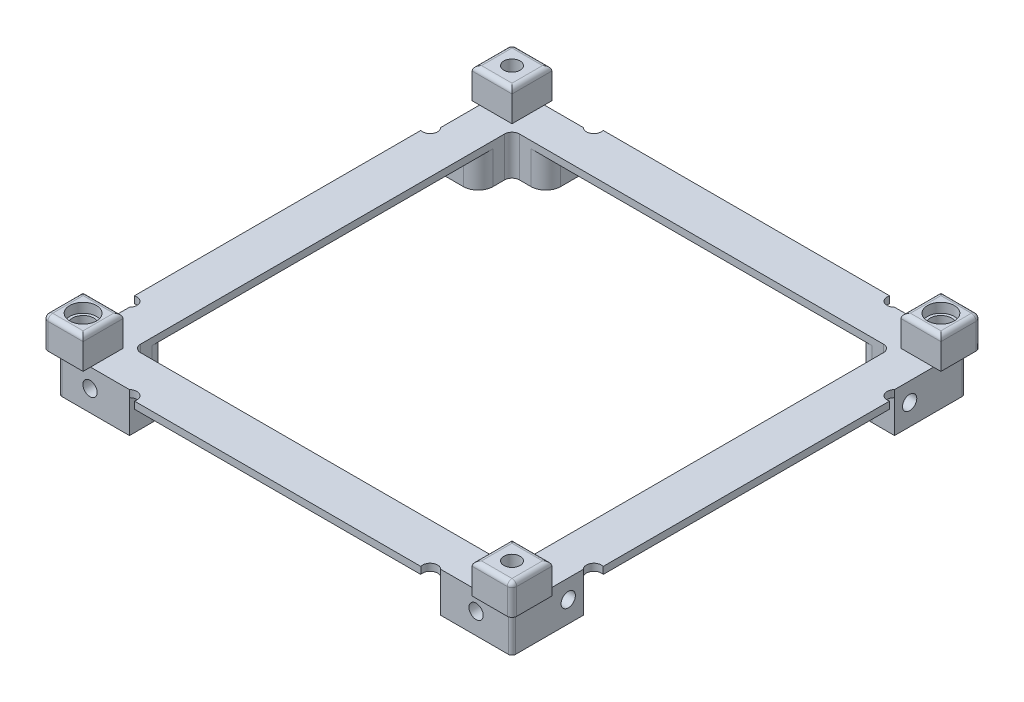
from build123d import *

# Parameters (mm, degrees)
SKETCH1_W                         = 100
SKETCH1_H                         = 100
BOSS_EXTRUDE1_DEPTH               = 8.5
CUT_EXTRUDE1_DEPTH                = 142.676568281
SKETCH3_W                         = 8.5
SKETCH3_H                         = 8.5
BOSS_EXTRUDE2_DEPTH               = 6.5
TAP_DRILL_FOR_4_HELICOIL5_D       = 3.048
TAP_DRILL_FOR_4_HELICOIL5_DEPTH   = 5.69
TAP_DRILL_FOR_4_HELICOIL5_TIP     = 0.915711583
TAP_DRILL_FOR_4_HELICOIL5_4_D     = 3.048
TAP_DRILL_FOR_4_HELICOIL5_4_DEPTH = 5.69
TAP_DRILL_FOR_4_HELICOIL5_4_TIP   = 0.915711583
CUT_EXTRUDE2_DEPTH                = 7
CUT_EXTRUDE3_DEPTH                = 142.647449677
FILLET1_R                         = 1
FILLET2_R                         = 3.175
FILLET3_R                         = 0.79
TAP_DRILL_FOR_4_HELICOIL5_5_D     = 3.048
TAP_DRILL_FOR_4_HELICOIL5_5_DEPTH = 5.69
TAP_DRILL_FOR_4_HELICOIL5_5_TIP   = 0.915711583
TAP_DRILL_FOR_8_32_TAP1_D         = 3.4544
TAP_DRILL_FOR_8_32_TAP1_DEPTH     = 11.0998
TAP_DRILL_FOR_8_32_TAP1_TIP       = 1.037806461
SKETCH27_R                        = 2.8575
CUT_EXTRUDE4_DEPTH                = 2.032
SKETCH28_R                        = 2.286
CUT_EXTRUDE5_DEPTH                = 4.318
F_4_CLEARANCE_HOLE1_D             = 3.4544


with BuildPart() as part:
    # Sketch1 → Boss-Extrude1 (new body)
    with BuildSketch(Plane(origin=(0, 0, 0), x_dir=(1, 0, 0), z_dir=(0, 1, 0))):
        with Locations((50, 50)):
            Rectangle(SKETCH1_W, SKETCH1_H)
    extrude(amount=BOSS_EXTRUDE1_DEPTH)

    # Sketch2 → Cut-Extrude1 (cut, through all)
    with BuildSketch(Plane(origin=(0, 8.5, 0), x_dir=(1, 0, 0), z_dir=(0, 1, 0))):
        with BuildLine():
            Line((19.05, 100), (0, 100))
            Line((0, 100), (0, 83.590412453))
            Line((0, 83.590412453), (0, 80.95))
            Line((0, 80.95), (0, 80.554651577))
            ThreePointArc((0, 80.554651577), (1.825498063, 81.254538032), (1.5875, 83.19506403))
            Line((1.5875, 83.19506403), (1.5875, 98.4125))
            Line((1.5875, 98.4125), (16.80493597, 98.4125))
            ThreePointArc((16.80493597, 98.4125), (18.745461968, 98.174501937), (19.445348423, 100))
            Line((19.445348423, 100), (19.05, 100))
        make_face()
        with BuildLine():
            Line((80.95, 100), (80.554651577, 100))
            ThreePointArc((80.554651577, 100), (81.254538032, 98.174501937), (83.19506403, 98.4125))
            Line((83.19506403, 98.4125), (98.4125, 98.4125))
            Line((98.4125, 98.4125), (98.4125, 83.19506403))
            ThreePointArc((98.4125, 83.19506403), (98.174501937, 81.254538032), (100, 80.554651577))
            Line((100, 80.554651577), (100, 80.95))
            Line((100, 80.95), (100, 83.590412453))
            Line((100, 83.590412453), (100, 100))
            Line((100, 100), (80.95, 100))
        make_face()
        with BuildLine():
            Line((1.5875, 1.5875), (16.80493597, 1.5875))
            ThreePointArc((16.80493597, 1.5875), (18.745461968, 1.825498063), (19.445348423, 0))
            Line((19.445348423, 0), (19.05, 0))
            Line((19.05, 0), (0, 0))
            Line((0, 0), (0, 19.05))
            Line((0, 19.05), (0, 19.445348423))
            ThreePointArc((0, 19.445348423), (1.825498063, 18.745461968), (1.5875, 16.80493597))
            Line((1.5875, 16.80493597), (1.5875, 1.5875))
        make_face()
        with BuildLine():
            Line((98.4125, 1.5875), (83.19506403, 1.5875))
            ThreePointArc((83.19506403, 1.5875), (81.254538032, 1.825498063), (80.554651577, 0))
            Line((80.554651577, 0), (80.95, 0))
            Line((80.95, 0), (100, 0))
            Line((100, 0), (100, 19.05))
            Line((100, 19.05), (100, 19.445348423))
            ThreePointArc((100, 19.445348423), (98.174501937, 18.745461968), (98.4125, 16.80493597))
            Line((98.4125, 16.80493597), (98.4125, 1.5875))
        make_face()
    extrude(amount=-CUT_EXTRUDE1_DEPTH, mode=Mode.SUBTRACT)

    # Sketch3 → Boss-Extrude2 (add)
    with BuildSketch(Plane(origin=(0, 8.5, 0), x_dir=(1, 0, 0), z_dir=(0, 1, 0))):
        with Locations((4.25, 4.25)):
            Rectangle(SKETCH3_W, SKETCH3_H)
        with Locations((95.75, 4.25)):
            Rectangle(SKETCH3_W, SKETCH3_H)
        with Locations((95.75, 95.75)):
            Rectangle(SKETCH3_W, SKETCH3_H)
        with Locations((4.25, 95.75)):
            Rectangle(SKETCH3_W, SKETCH3_H)
    extrude(amount=BOSS_EXTRUDE2_DEPTH)

    # Tap Drill for _4 Helicoil5
    with Locations(Plane(origin=(0, 0, 0), x_dir=(-1, 0, 0), z_dir=(0, -1, 0))):
        with Locations((-87.465, 7.1375), (-90.005, 92.8625), (-13.805, 7.1375), (-9.995, 92.8625)):
            Hole(TAP_DRILL_FOR_4_HELICOIL5_D / 2, depth=TAP_DRILL_FOR_4_HELICOIL5_DEPTH)
            with Locations((0, 0, -(TAP_DRILL_FOR_4_HELICOIL5_DEPTH + TAP_DRILL_FOR_4_HELICOIL5_TIP / 2))):  # 118° drill point
                Cone(0, TAP_DRILL_FOR_4_HELICOIL5_D / 2, TAP_DRILL_FOR_4_HELICOIL5_TIP, mode=Mode.SUBTRACT)

    # Sketch18 → Tap Drill for _4 Helicoil5 2 (revolve, cut)
    with BuildSketch(Plane(origin=(1.5875, 4.5, -86.4125), x_dir=(0, 0, 1), z_dir=(0, 1, 0))):
        Polygon((0, 0), (0, 6.605711583), (1.524, 5.69), (1.524, 0), align=None)
    tap_drill_for_4_helicoil5_2 = revolve(axis=Axis((-4.7625, 4.5, -86.4125), (1, 0, 0)), mode=Mode.SUBTRACT)

    # Mirror1: Tap Drill for _4 Helicoil5 2 across plane
    add(tap_drill_for_4_helicoil5_2.mirror(Plane(origin=(0, 0, -50), x_dir=(1, 0, 0), z_dir=(0, 0, -1))), mode=Mode.SUBTRACT)

    # Mirror2: Tap Drill for _4 Helicoil5 2 across plane
    add(tap_drill_for_4_helicoil5_2.mirror(Plane.ZY.offset(-50)), mode=Mode.SUBTRACT)

    # Mirror2 copy 1 sketch → Mirror2 copy 1 (revolve, cut)
    with BuildSketch(Plane(origin=(98.4125, 4.5, -13.5875), x_dir=(0, 0, -1), z_dir=(0, 1, 0))):
        Polygon((0, 0), (0, 6.605711583), (1.524, 5.69), (1.524, 0), align=None)
    revolve(axis=Axis((104.7625, 4.5, -13.5875), (-1, 0, 0)), mode=Mode.SUBTRACT)

    # Sketch21 → Tap Drill for _4 Helicoil5 3 (revolve, cut)
    with BuildSketch(Plane(origin=(13.5875, 4.5, -98.4125), x_dir=(0, 1, 0), z_dir=(1, 0, 0))):
        Polygon((0, 0), (0, 6.605711583), (1.524, 5.69), (1.524, 0), align=None)
    tap_drill_for_4_helicoil5_3 = revolve(axis=Axis((13.5875, 4.5, -104.7625), (0, 0, 1)), mode=Mode.SUBTRACT)

    # Mirror3: Tap Drill for _4 Helicoil5 3 across plane
    add(tap_drill_for_4_helicoil5_3.mirror(Plane.ZY.offset(-50)), mode=Mode.SUBTRACT)

    # Tap Drill for _4 Helicoil5 4
    with Locations(Plane.XY.offset(-1.5875)):
        with Locations((90.7525, 4.5)):
            Hole(TAP_DRILL_FOR_4_HELICOIL5_4_D / 2, depth=TAP_DRILL_FOR_4_HELICOIL5_4_DEPTH)
            with Locations((0, 0, -(TAP_DRILL_FOR_4_HELICOIL5_4_DEPTH + TAP_DRILL_FOR_4_HELICOIL5_4_TIP / 2))):  # 118° drill point
                Cone(0, TAP_DRILL_FOR_4_HELICOIL5_4_D / 2, TAP_DRILL_FOR_4_HELICOIL5_4_TIP, mode=Mode.SUBTRACT)

    # Sketch22 → Cut-Extrude2 (cut)
    with BuildSketch(Plane.XZ):
        with BuildLine():
            Line((83.19506403, -9.5875), (88.825, -9.5875))
            ThreePointArc((88.825, -9.5875), (89.947532015, -10.052467985), (90.4125, -11.175))
            Line((90.4125, -11.175), (90.4125, -16.80493597))
            Line((90.4125, -16.80493597), (98.4125, -16.80493597))
            Line((98.4125, -16.80493597), (100, -16.80493597))
            Line((100, -16.80493597), (100, -83.19506403))
            Line((100, -83.19506403), (98.4125, -83.19506403))
            Line((98.4125, -83.19506403), (90.4125, -83.19506403))
            Line((90.4125, -83.19506403), (90.4125, -88.825))
            ThreePointArc((90.4125, -88.825), (89.947532015, -89.947532015), (88.825, -90.4125))
            Line((88.825, -90.4125), (83.19506403, -90.4125))
            Line((83.19506403, -90.4125), (83.19506403, -98.4125))
            Line((83.19506403, -98.4125), (83.19506403, -100))
            Line((83.19506403, -100), (16.80493597, -100))
            Line((16.80493597, -100), (16.80493597, -98.4125))
            Line((16.80493597, -98.4125), (16.80493597, -90.4125))
            Line((16.80493597, -90.4125), (11.175, -90.4125))
            ThreePointArc((11.175, -90.4125), (10.052467985, -89.947532015), (9.5875, -88.825))
            Line((9.5875, -88.825), (9.5875, -83.19506403))
            Line((9.5875, -83.19506403), (1.5875, -83.19506403))
            Line((1.5875, -83.19506403), (0, -83.19506403))
            Line((0, -83.19506403), (0, -16.80493597))
            Line((0, -16.80493597), (1.5875, -16.80493597))
            Line((1.5875, -16.80493597), (9.5875, -16.80493597))
            Line((9.5875, -16.80493597), (9.5875, -11.175))
            ThreePointArc((9.5875, -11.175), (10.052467985, -10.052467985), (11.175, -9.5875))
            Line((11.175, -9.5875), (16.80493597, -9.5875))
            Line((16.80493597, -9.5875), (16.80493597, -1.5875))
            Line((16.80493597, -1.5875), (16.80493597, 0))
            Line((16.80493597, 0), (83.19506403, 0))
            Line((83.19506403, 0), (83.19506403, -1.5875))
            Line((83.19506403, -1.5875), (83.19506403, -9.5875))
        make_face()
    extrude(amount=-CUT_EXTRUDE2_DEPTH, mode=Mode.SUBTRACT)

    # Sketch23 → Cut-Extrude3 (cut, through all)
    with BuildSketch(Plane.XZ.offset(-7)):
        with BuildLine():
            Line((11.175, -90.4125), (88.825, -90.4125))
            ThreePointArc((88.825, -90.4125), (89.947532015, -89.947532015), (90.4125, -88.825))
            Line((90.4125, -88.825), (90.4125, -11.175))
            ThreePointArc((90.4125, -11.175), (89.947532015, -10.052467985), (88.825, -9.5875))
            Line((88.825, -9.5875), (11.175, -9.5875))
            ThreePointArc((11.175, -9.5875), (10.052467985, -10.052467985), (9.5875, -11.175))
            Line((9.5875, -11.175), (9.5875, -88.825))
            ThreePointArc((9.5875, -88.825), (10.052467985, -89.947532015), (11.175, -90.4125))
        make_face()
    extrude(amount=-CUT_EXTRUDE3_DEPTH, mode=Mode.SUBTRACT)

    # Fillet1
    fillet1_edges = [part.edges().sort_by_distance(p)[0] for p in [
        (0, 11.75, 0),
        (0, 15, -4.25),
        (4.25, 15, 0),
        (8.5, 15, -4.25),
        (4.25, 15, -8.5),
        (100, 11.75, 0),
        (100, 15, -4.25),
        (95.75, 15, -8.5),
        (91.5, 15, -4.25),
        (95.75, 15, 0),
        (100, 11.75, -100),
        (95.75, 15, -100),
        (91.5, 15, -95.75),
        (95.75, 15, -91.5),
        (100, 15, -95.75),
        (0, 11.75, -100),
        (0, 15, -95.75),
        (4.25, 15, -91.5),
        (8.5, 15, -95.75),
        (4.25, 15, -100),
    ]]
    fillet(fillet1_edges, radius=FILLET1_R)

    # Fillet2
    fillet2_edges = [part.edges().sort_by_distance(p)[0] for p in [
        (9.5875, 3.5, -83.19506403),
        (90.4125, 3.5, -16.80493597),
        (90.4125, 3.5, -83.19506403),
        (83.19506403, 3.5, -90.4125),
        (16.80493597, 3.5, -90.4125),
        (9.5875, 3.5, -16.80493597),
        (16.80493597, 3.5, -9.5875),
        (83.19506403, 3.5, -9.5875),
    ]]
    fillet(fillet2_edges, radius=FILLET2_R)

    # Fillet3
    fillet3_edges = [part.edges().sort_by_distance(p)[0] for p in [
        (98.4125, 4.25, -98.4125),
        (1.5875, 4.25, -1.5875),
        (98.4125, 4.25, -1.5875),
        (1.5875, 4.25, -98.4125),
    ]]
    fillet(fillet3_edges, radius=FILLET3_R)

    # Tap Drill for _4 Helicoil5 5
    with Locations(Plane.XY.offset(-1.5875)):
        with Locations((8.3875, 4.5)):
            Hole(TAP_DRILL_FOR_4_HELICOIL5_5_D / 2, depth=TAP_DRILL_FOR_4_HELICOIL5_5_DEPTH)
            with Locations((0, 0, -(TAP_DRILL_FOR_4_HELICOIL5_5_DEPTH + TAP_DRILL_FOR_4_HELICOIL5_5_TIP / 2))):  # 118° drill point
                Cone(0, TAP_DRILL_FOR_4_HELICOIL5_5_D / 2, TAP_DRILL_FOR_4_HELICOIL5_5_TIP, mode=Mode.SUBTRACT)

    # Tap Drill for #8-32 Tap1
    with Locations(Plane(origin=(0, 15, 0), x_dir=(1, 0, 0), z_dir=(0, 1, 0))):
        with Locations((4.25, 95.75), (95.75, 4.25)):
            Hole(TAP_DRILL_FOR_8_32_TAP1_D / 2, depth=TAP_DRILL_FOR_8_32_TAP1_DEPTH)
            with Locations((0, 0, -(TAP_DRILL_FOR_8_32_TAP1_DEPTH + TAP_DRILL_FOR_8_32_TAP1_TIP / 2))):  # 118° drill point
                Cone(0, TAP_DRILL_FOR_8_32_TAP1_D / 2, TAP_DRILL_FOR_8_32_TAP1_TIP, mode=Mode.SUBTRACT)

    # Sketch27 → Cut-Extrude4 (cut)
    with BuildSketch(Plane(origin=(0, 15, 0), x_dir=(1, 0, 0), z_dir=(0, 1, 0))):
        with Locations(Location((95.75, 95.75, 0), (0, 0, 270))):
            Circle(SKETCH27_R)
        with Locations(Location((4.25, 4.25, 0), (0, 0, 270))):
            Circle(SKETCH27_R)
    extrude(amount=-CUT_EXTRUDE4_DEPTH, mode=Mode.SUBTRACT)

    # Sketch28 → Cut-Extrude5 (cut)
    with BuildSketch(Plane(origin=(0, 12.968, 0), x_dir=(1, 0, 0), z_dir=(0, 1, 0))):
        with Locations(Location((95.75, 95.75, 0), (0, 0, 270))):
            Circle(SKETCH28_R)
        with Locations(Location((4.25, 4.25, 0), (0, 0, 270))):
            Circle(SKETCH28_R)
    extrude(amount=-CUT_EXTRUDE5_DEPTH, mode=Mode.SUBTRACT)

    # #4 Clearance Hole1 (through all)
    with Locations(Plane(origin=(0, 8.65, 0), x_dir=(1, 0, 0), z_dir=(0, 1, 0))):
        with Locations((4.25, 4.25), (95.75, 95.75)):
            Hole(F_4_CLEARANCE_HOLE1_D / 2)


solid = part.part
